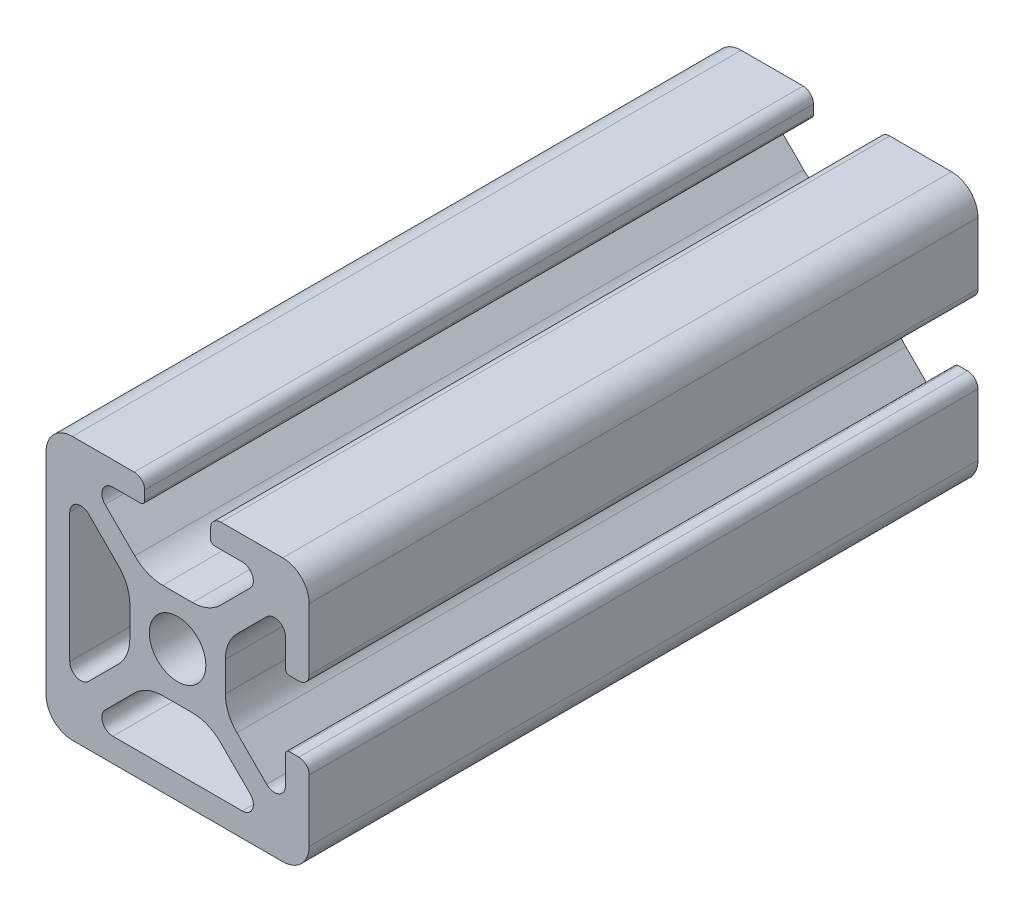
from build123d import *

# Parameters (mm, degrees)
SKETCH1_R           = 2.1463
BOSS_EXTRUDE1_DEPTH = 25.4


with BuildPart() as part:
    # Sketch1 → Boss-Extrude1 (new, symmetric)
    with BuildSketch(Plane.XY):
        with BuildLine():
            Line((-9.9949, 7.9883), (-9.9949, -7.9883))
            ThreePointArc((-9.9949, -7.9883), (-9.407180467, -9.407180467), (-7.9883, -9.9949))
            Line((-7.9883, -9.9949), (7.9883, -9.9949))
            ThreePointArc((7.9883, -9.9949), (9.407180467, -9.407180467), (9.9949, -7.9883))
            Line((9.9949, -7.9883), (9.9949, -3.2893))
            ThreePointArc((9.9949, -3.2893), (9.76427588, -2.73252412), (9.2075, -2.5019))
            Line((9.2075, -2.5019), (8.4963, -2.5019))
            ThreePointArc((8.4963, -2.5019), (8.280773853, -2.591173853), (8.1915, -2.8067))
            Line((8.1915, -2.8067), (8.1915, -4.9149))
            ThreePointArc((8.1915, -4.9149), (7.674065253, -5.689295824), (6.760603096, -5.507596904))
            Line((6.760603096, -5.507596904), (4.505765747, -3.252759555))
            ThreePointArc((4.505765747, -3.252759555), (3.856054457, -2.280397894), (3.627906192, -1.133419111))
            Line((3.627906192, -1.133419111), (3.627906192, 1.133419111))
            ThreePointArc((3.627906192, 1.133419111), (3.856054457, 2.280397894), (4.505765747, 3.252759555))
            Line((4.505765747, 3.252759555), (6.760603096, 5.507596904))
            ThreePointArc((6.760603096, 5.507596904), (7.674065253, 5.689295824), (8.1915, 4.9149))
            Line((8.1915, 4.9149), (8.1915, 2.8067))
            ThreePointArc((8.1915, 2.8067), (8.280773853, 2.591173853), (8.4963, 2.5019))
            Line((8.4963, 2.5019), (9.2075, 2.5019))
            ThreePointArc((9.2075, 2.5019), (9.76427588, 2.73252412), (9.9949, 3.2893))
            Line((9.9949, 3.2893), (9.9949, 7.9883))
            ThreePointArc((9.9949, 7.9883), (9.407180467, 9.407180467), (7.9883, 9.9949))
            Line((7.9883, 9.9949), (3.2893, 9.9949))
            ThreePointArc((3.2893, 9.9949), (2.73252412, 9.76427588), (2.5019, 9.2075))
            Line((2.5019, 9.2075), (2.5019, 8.4963))
            ThreePointArc((2.5019, 8.4963), (2.591173853, 8.280773853), (2.8067, 8.1915))
            Line((2.8067, 8.1915), (4.9149, 8.1915))
            ThreePointArc((4.9149, 8.1915), (5.689295824, 7.674065253), (5.507596904, 6.760603096))
            Line((5.507596904, 6.760603096), (3.252759555, 4.505765747))
            ThreePointArc((3.252759555, 4.505765747), (2.280397894, 3.856054457), (1.133419111, 3.627906192))
            Line((1.133419111, 3.627906192), (-1.133419111, 3.627906192))
            ThreePointArc((-1.133419111, 3.627906192), (-2.280397894, 3.856054457), (-3.252759555, 4.505765747))
            Line((-3.252759555, 4.505765747), (-5.507596904, 6.760603096))
            ThreePointArc((-5.507596904, 6.760603096), (-5.689295824, 7.674065253), (-4.9149, 8.1915))
            Line((-4.9149, 8.1915), (-2.8067, 8.1915))
            ThreePointArc((-2.8067, 8.1915), (-2.591173853, 8.280773853), (-2.5019, 8.4963))
            Line((-2.5019, 8.4963), (-2.5019, 9.2075))
            ThreePointArc((-2.5019, 9.2075), (-2.73252412, 9.76427588), (-3.2893, 9.9949))
            Line((-3.2893, 9.9949), (-7.9883, 9.9949))
            ThreePointArc((-7.9883, 9.9949), (-9.407180467, 9.407180467), (-9.9949, 7.9883))
        make_face()
        Circle(SKETCH1_R, mode=Mode.SUBTRACT)
        with BuildLine():
            Line((-6.760603096, 5.507596904), (-4.505765747, 3.252759555))
            ThreePointArc((-4.505765747, 3.252759555), (-3.856054457, 2.280397894), (-3.627906192, 1.133419111))
            Line((-3.627906192, 1.133419111), (-3.627906192, -1.133419111))
            ThreePointArc((-3.627906192, -1.133419111), (-3.856054457, -2.280397894), (-4.505765747, -3.252759555))
            Line((-4.505765747, -3.252759555), (-6.760603096, -5.507596904))
            ThreePointArc((-6.760603096, -5.507596904), (-7.674065253, -5.689295824), (-8.1915, -4.9149))
            Line((-8.1915, -4.9149), (-8.1915, 4.9149))
            ThreePointArc((-8.1915, 4.9149), (-7.674065253, 5.689295824), (-6.760603096, 5.507596904))
        make_face(mode=Mode.SUBTRACT)
        with BuildLine():
            Line((-5.507596904, -6.760603096), (-3.252759555, -4.505765747))
            ThreePointArc((-3.252759555, -4.505765747), (-2.280397894, -3.856054457), (-1.133419111, -3.627906192))
            Line((-1.133419111, -3.627906192), (1.133419111, -3.627906192))
            ThreePointArc((1.133419111, -3.627906192), (2.280397894, -3.856054457), (3.252759555, -4.505765747))
            Line((3.252759555, -4.505765747), (5.507596904, -6.760603096))
            ThreePointArc((5.507596904, -6.760603096), (5.689295824, -7.674065253), (4.9149, -8.1915))
            Line((4.9149, -8.1915), (-4.9149, -8.1915))
            ThreePointArc((-4.9149, -8.1915), (-5.689295824, -7.674065253), (-5.507596904, -6.760603096))
        make_face(mode=Mode.SUBTRACT)
    extrude(amount=BOSS_EXTRUDE1_DEPTH, both=True)


solid = part.part
